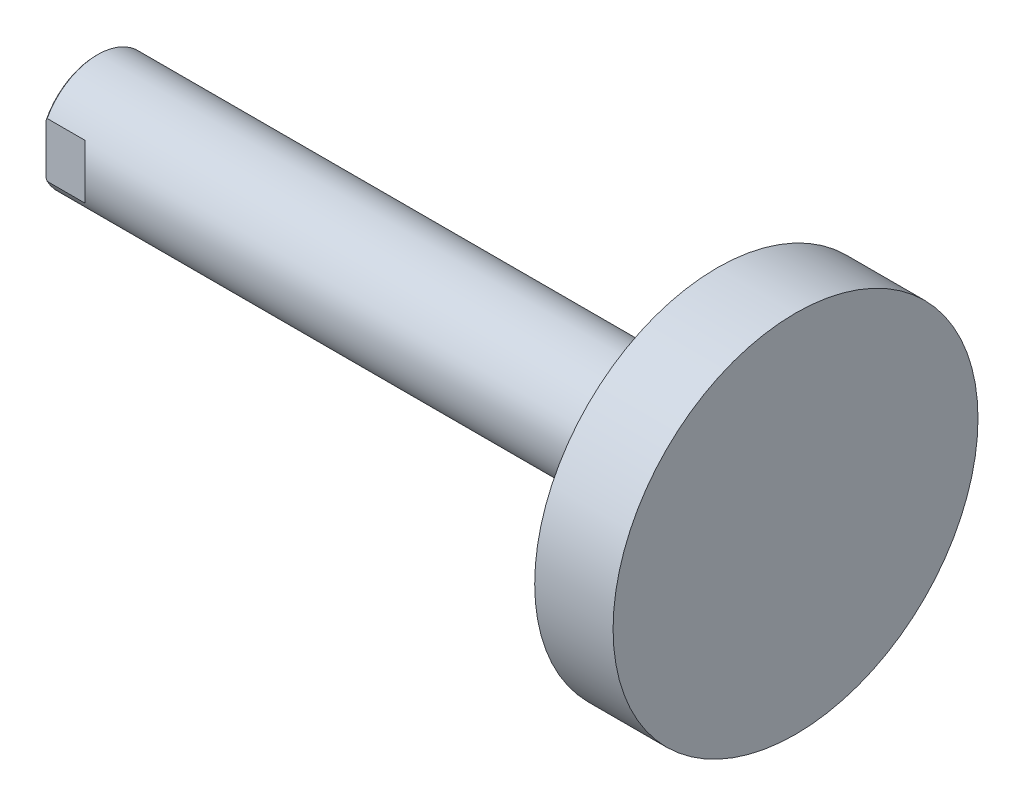
from build123d import *

# Parameters (mm, degrees)
CUT_EXTRUDE_1_DEPTH       = 22
CUT_EXTRUDE_1_DEPTH_BACK  = 22
HOLE_WIZARD_1_D           = 13.835
HOLE_WIZARD_1_DEPTH       = 24
HOLE_WIZARD_1_CSINK_D     = 16
HOLE_WIZARD_1_CSINK_ANGLE = 90
HOLE_WIZARD_1_TIP         = 3.993820487


with BuildPart() as part:
    # 草图1 → 旋转1 (revolve)
    with BuildSketch(Plane.XY):
        Polygon((-10, 0), (-10, 12.25), (-9.75, 12.5), (0, 12.5), (0, 0), align=None)
    revolve(axis=Axis((0, 0, 0), (-1, 0, 0)))

    # 草图2 → 旋转2 (revolve)
    with BuildSketch(Plane.XY):
        Polygon((0, 0), (0, 12.5), (125.4, 12.5), (125.4, 39.8), (142.5, 39.8), (142.5, 0), align=None)
    revolve(axis=Axis((142.5, 0, 0), (-1, 0, 0)))

    # 草图3 → 切除-拉伸1 (cut, two sides: drawn at the far end of the back side and taken through both)
    with BuildSketch(Plane(origin=(0, 0, 0), x_dir=(1, 0, 0), z_dir=(0, 1, 0)).offset(-CUT_EXTRUDE_1_DEPTH_BACK)):
        Polygon((-20, -16), (3.5, -16), (-1.5, -11), (-10, -11), (-10, 11), (-1.5, 11), (3.5, 16), (-20, 16), align=None)
    extrude(amount=CUT_EXTRUDE_1_DEPTH + CUT_EXTRUDE_1_DEPTH_BACK, mode=Mode.SUBTRACT)

    # 孔1
    with Locations(Plane.ZY.offset(10)):
        with Locations((0, 0)):
            CounterSinkHole(HOLE_WIZARD_1_D / 2, HOLE_WIZARD_1_CSINK_D / 2, depth=HOLE_WIZARD_1_DEPTH, counter_sink_angle=HOLE_WIZARD_1_CSINK_ANGLE)
            with Locations((0, 0, -(HOLE_WIZARD_1_DEPTH + HOLE_WIZARD_1_TIP / 2))):  # 120° drill point
                Cone(0, HOLE_WIZARD_1_D / 2, HOLE_WIZARD_1_TIP, mode=Mode.SUBTRACT)


solid = part.part
